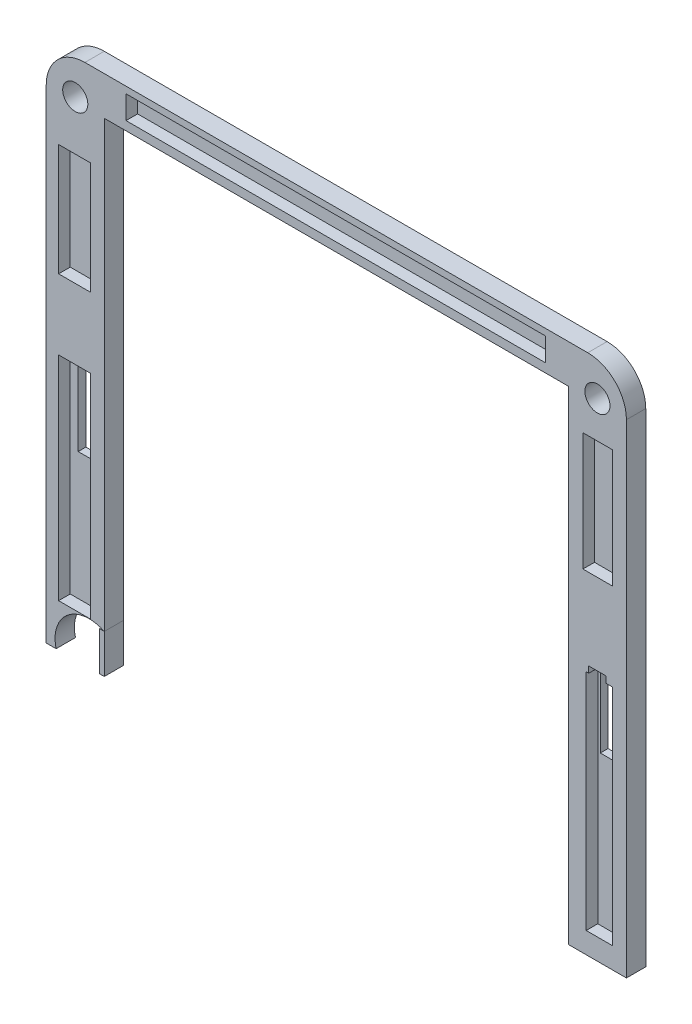
from build123d import *

# Parameters (mm, degrees)
SKETCH2_W           = 120
SKETCH2_H           = 115
BOSS_EXTRUDE1_DEPTH = 152
SKETCH3_W           = 120
SKETCH3_H           = 13.389184999
CUT_EXTRUDE1_DEPTH  = 192.155706765
SKETCH5_R           = 3.25
CUT_EXTRUDE2_DEPTH  = 30
SKETCH6_W           = 4.5
SKETCH6_H           = 21
CUT_EXTRUDE4_DEPTH  = 16
CUT_EXTRUDE5_START  = -15
SKETCH7_R           = 3.25
CUT_EXTRUDE5_DEPTH  = 15
SKETCH8_W           = 8.291807731
SKETCH8_H           = 28.961241497
SKETCH8_H_2         = 55.038375958
SKETCH8_W_2         = 108.394356143
SKETCH8_H_3         = 6.008556327
SKETCH8_W_3         = 7.690952099
SKETCH8_H_4         = 30.523466142
SKETCH8_W_4         = 6.849754213
SKETCH8_H_5         = 57.922482994
CUT_EXTRUDE6_DEPTH  = 150
CUT_EXTRUDE7_DEPTH  = 192.155706765
SKETCH10_W          = 147
SKETCH10_H          = 135
CUT_EXTRUDE8_DEPTH  = 226.028821495


with BuildPart() as part:
    # Sketch2 → Boss-Extrude1 (new body)
    with BuildSketch(Plane.XY):
        with BuildLine():
            Line((-48.334664537, 64.049520767), (81.665335463, 64.049520767))
            ThreePointArc((81.665335463, 64.049520767), (88.736403275, 61.120588579), (91.665335463, 54.049520767))
            Line((91.665335463, 54.049520767), (91.665335463, -70.950479233))
            Line((91.665335463, -70.950479233), (-58.334664537, -70.950479233))
            Line((-58.334664537, -70.950479233), (-58.334664537, 54.049520767))
            ThreePointArc((-58.334664537, 54.049520767), (-55.405732349, 61.120588579), (-48.334664537, 64.049520767))
        make_face()
        with Locations((16.665335463, -3.450479233)):
            Rectangle(SKETCH2_W, SKETCH2_H, mode=Mode.SUBTRACT)
    extrude(amount=BOSS_EXTRUDE1_DEPTH)

    # Sketch3 → Cut-Extrude1 (cut, through all)
    with BuildSketch(Plane.XY.offset(152)):
        with Locations((16.665335463, -67.645071732)):
            Rectangle(SKETCH3_W, SKETCH3_H)
    extrude(amount=-CUT_EXTRUDE1_DEPTH, mode=Mode.SUBTRACT)

    # Sketch5 → Cut-Extrude2 (cut)
    with BuildSketch(Plane(origin=(0, 0, 0), x_dir=(-1, 0, 0), z_dir=(0, 0, -1))):
        with Locations((-84.165335463, 55.049520767)):
            Circle(SKETCH5_R)
        with Locations((50.834664537, 55.049520767)):
            Circle(SKETCH5_R)
    extrude(amount=-CUT_EXTRUDE2_DEPTH, mode=Mode.SUBTRACT)

    # Sketch6 → Cut-Extrude4 (cut)
    with BuildSketch(Plane(origin=(0, 0, 0), x_dir=(-1, 0, 0), z_dir=(0, 0, -1))):
        with Locations((50.834664537, -16.450479233)):
            Rectangle(SKETCH6_W, SKETCH6_H)
        with Locations((-84.165335463, -16.450479233)):
            Rectangle(SKETCH6_W, SKETCH6_H)
    extrude(amount=-CUT_EXTRUDE4_DEPTH, mode=Mode.SUBTRACT)

    # Sketch7 → Cut-Extrude5 (cut)
    with BuildSketch(Plane.XY.offset(152).offset(CUT_EXTRUDE5_START)):
        with Locations((-50.834664537, 55.049520767)):
            Circle(SKETCH7_R)
        with Locations((-50.834664537, 4.049520767)):
            Circle(SKETCH7_R)
        with Locations((84.165335463, 4.049520767)):
            Circle(SKETCH7_R)
        with Locations((84.165335463, 55.049520767)):
            Circle(SKETCH7_R)
    extrude(amount=CUT_EXTRUDE5_DEPTH, mode=Mode.SUBTRACT)

    # Sketch8 → Cut-Extrude6 (cut)
    with BuildSketch(Plane.XY.offset(152)):
        with Locations((-50.991008781, 27.795371112)):
            Rectangle(SKETCH8_W, SKETCH8_H)
        with Locations((-50.991008781, -32.350277723)):
            Rectangle(SKETCH8_W, SKETCH8_H_2)
        with Locations((16.485078773, 59.340291831)):
            Rectangle(SKETCH8_W_2, SKETCH8_H_3)
        with Locations((84.261594145, 30.258879207)):
            Rectangle(SKETCH8_W_3, SKETCH8_H_4)
        with Locations((84.682193087, -36.556267152)):
            Rectangle(SKETCH8_W_4, SKETCH8_H_5)
    extrude(amount=-CUT_EXTRUDE6_DEPTH, mode=Mode.SUBTRACT)

    # Sketch9 → Cut-Extrude7 (cut, through all)
    with BuildSketch(Plane.XY.offset(152)):
        with BuildLine():
            Line((-55.78242584, -70.950479233), (-44.573216516, -70.950479233))
            Line((-44.573216516, -70.950479233), (-44.573216516, -60.861864812))
            Line((-44.573216516, -60.861864812), (-43.334664537, -60.861864812))
            ThreePointArc((-43.334664537, -60.861864812), (-52.78845028, -61.92097783), (-55.78242584, -70.950479233))
        make_face()
    extrude(amount=-CUT_EXTRUDE7_DEPTH, mode=Mode.SUBTRACT)


with BuildPart() as cut_extrude7_piece_1:
    # of the separate pieces the step leaves, piece 1, a body of its own (cut_extrude7_pieces)
    add(part.part.solids().sort_by_distance((-48.334664537, 64.049520767, 0))[0])


with BuildPart() as cut_extrude7_piece_2:
    # of the separate pieces the step leaves, piece 2, a body of its own (cut_extrude7_pieces)
    add(part.part.solids().sort_by_distance((-43.334664537, -70.950479233, 0))[0])


with BuildPart() as cut_extrude8_tool:
    # Sketch10 → Cut-Extrude8 (new, through all)
    with BuildSketch(Plane(origin=(91.665335463, 0, 0), x_dir=(0, 0, -1), z_dir=(1, 0, 0))):
        with Locations((-78.5, -3.450479233)):
            Rectangle(SKETCH10_W, SKETCH10_H)
    extrude(amount=-CUT_EXTRUDE8_DEPTH)


with BuildPart() as cut_extrude7_piece_1_1:
    add(cut_extrude7_piece_1.part)

    # Cut-Extrude8: cut by cut_extrude8_tool
    add(cut_extrude8_tool.part, mode=Mode.SUBTRACT)


with BuildPart() as cut_extrude7_piece_2_1:
    add(cut_extrude7_piece_2.part)

    # Cut-Extrude8: cut by cut_extrude8_tool
    add(cut_extrude8_tool.part, mode=Mode.SUBTRACT)


solid = Compound([cut_extrude7_piece_1_1.part, cut_extrude7_piece_2_1.part])
